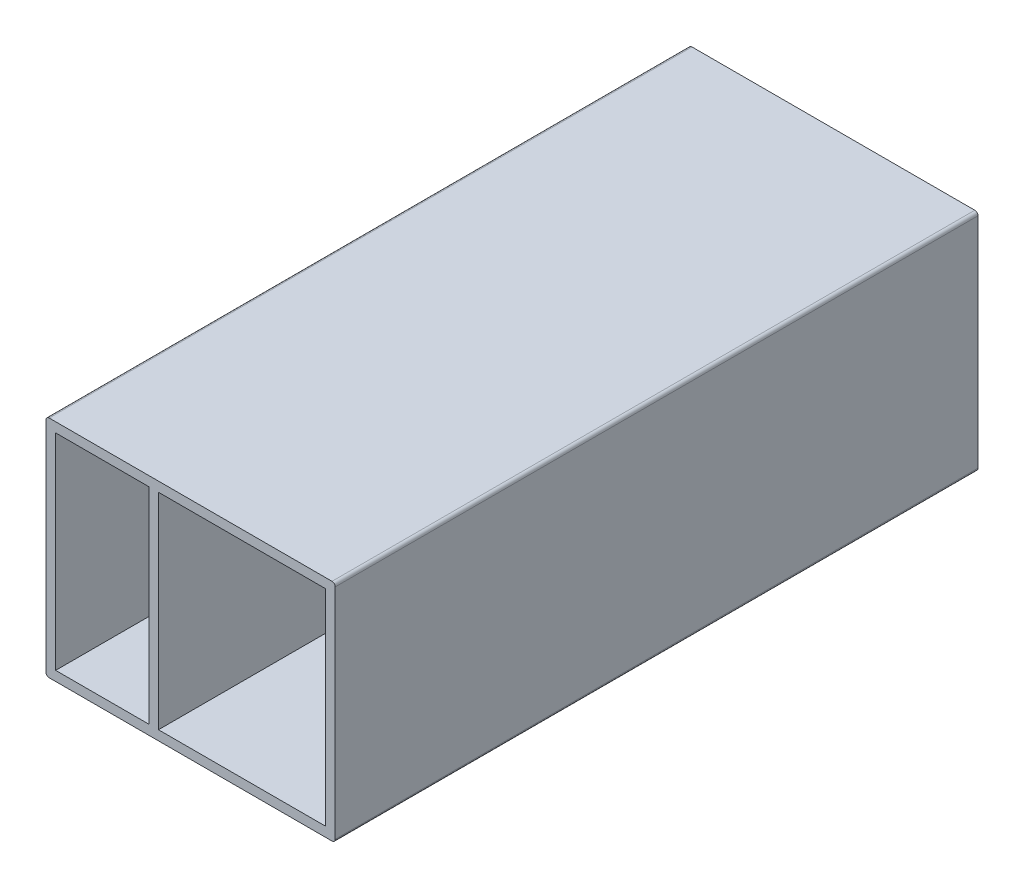
from build123d import *

# Parameters (mm, degrees)
ESBO_O1_W                = 90
ESBO_O1_H                = 70
ESBO_O1_W_2              = 29
ESBO_O1_H_2              = 64
ESBO_O1_W_3              = 52
RESSALTO_EXTRUS_O1_DEPTH = 200
FILETE1_R                = 1
ESBO_O4_R                = 4.75
ESBO_O4_R_2              = 2
CORTE_EXTRUS_O1_DEPTH    = 3
ESBO_O5_W                = 10.309676721
ESBO_O5_H                = 50
CORTE_EXTRUS_O2_DEPTH    = 5


with BuildPart() as part:
    # Esboço1 → Ressalto-extrusão1 (new body)
    with BuildSketch(Plane.XY):
        Rectangle(ESBO_O1_W, ESBO_O1_H)
        with Locations((-27.5, 0)):
            Rectangle(ESBO_O1_W_2, ESBO_O1_H_2, mode=Mode.SUBTRACT)
        with Locations((16, 0)):
            Rectangle(ESBO_O1_W_3, ESBO_O1_H_2, mode=Mode.SUBTRACT)
    extrude(amount=RESSALTO_EXTRUS_O1_DEPTH)

    # Filete1
    filete1_edges = [part.edges().sort_by_distance(p)[0] for p in [
        (45, -35, 100),
        (-45, -35, 100),
        (-45, 35, 100),
        (45, 35, 100),
    ]]
    fillet(filete1_edges, radius=FILETE1_R)

    # Esboço4 → Corte-extrusão1 (cut)
    with BuildSketch(Plane(origin=(-10, 0, 0), x_dir=(0, 0, -1), z_dir=(1, 0, 0))):
        with Locations(Location((-100, 0, 0), (0, 0, 90))):
            Circle(ESBO_O4_R)
        with Locations(Location((-92, 19.69381461, 0), (0, 0, 90))):
            Circle(ESBO_O4_R_2)
        with Locations(Location((-92, -16.897667481, 0), (0, 0, 90))):
            Circle(ESBO_O4_R_2)
    extrude(amount=-CORTE_EXTRUS_O1_DEPTH, mode=Mode.SUBTRACT)

    # Esboço5 → Corte-extrusão2 (cut)
    with BuildSketch(Plane(origin=(0, 0, 0), x_dir=(-1, 0, 0), z_dir=(0, 0, -1))):
        with Locations((43.55720026, 0)):
            Rectangle(ESBO_O5_W, ESBO_O5_H)
    extrude(amount=-CORTE_EXTRUS_O2_DEPTH, mode=Mode.SUBTRACT)


solid = part.part
